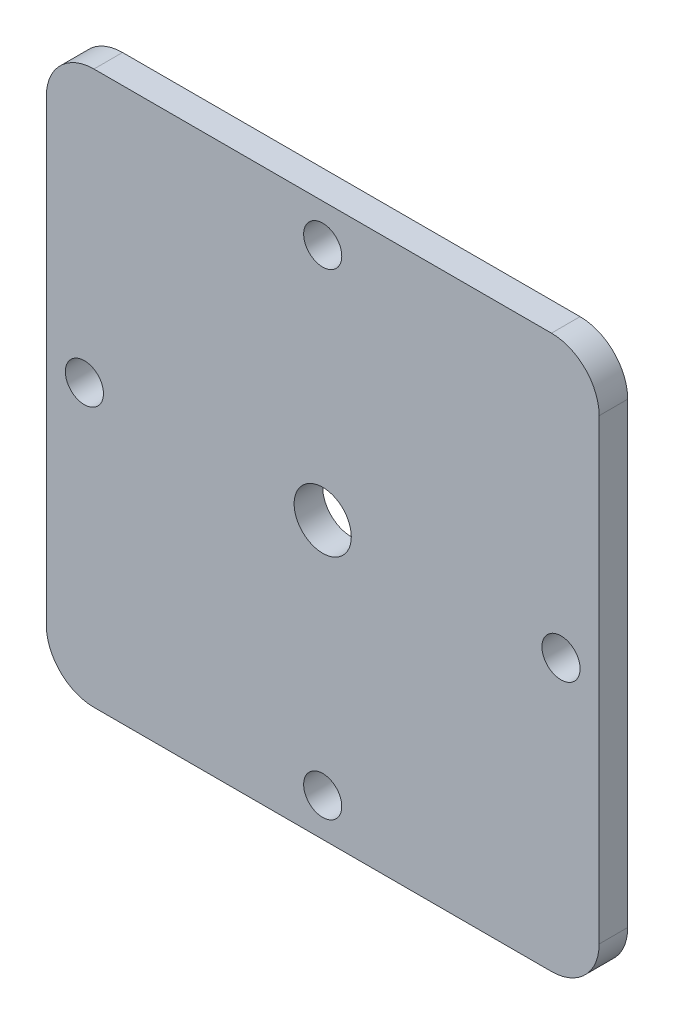
from build123d import *

# Parameters (mm, degrees)
SKETCH_1_W          = 58
SKETCH_1_H          = 58
SKETCH_1_R          = 2
EXTRUDE_1_DEPTH     = 3
FILLET_2_R          = 5
FILLET_3_R          = 5
FILLET_4_R          = 5
FILLET_5_R          = 5
SKETCH_2_R          = 3
CUT_EXTRUDE_1_DEPTH = 3


with BuildPart() as part:
    # Эскиз1 → Бобышка-Вытянуть1 (new body)
    with BuildSketch(Plane.XY):
        Rectangle(SKETCH_1_W, SKETCH_1_H)
        with Locations((0, 25)):
            Circle(SKETCH_1_R, mode=Mode.SUBTRACT)
        with Locations(Location((-25, 0, 0), (0, 0, 180))):
            Circle(SKETCH_1_R, mode=Mode.SUBTRACT)
        with Locations(Location((0, -25, 0), (0, 0, 180))):
            Circle(SKETCH_1_R, mode=Mode.SUBTRACT)
        with Locations(Location((25, 0, 0), (0, 0, 180))):
            Circle(SKETCH_1_R, mode=Mode.SUBTRACT)
    extrude(amount=EXTRUDE_1_DEPTH)

    # Скругление2
    fillet_2_edges = [part.edges().sort_by_distance(p)[0] for p in [
        (29, -29, 1.5),
    ]]
    fillet(fillet_2_edges, radius=FILLET_2_R)

    # Скругление3
    fillet_3_edges = [part.edges().sort_by_distance(p)[0] for p in [
        (-29, -29, 1.5),
    ]]
    fillet(fillet_3_edges, radius=FILLET_3_R)

    # Скругление4
    fillet_4_edges = [part.edges().sort_by_distance(p)[0] for p in [
        (-29, 29, 1.5),
    ]]
    fillet(fillet_4_edges, radius=FILLET_4_R)

    # Скругление5
    fillet_5_edges = [part.edges().sort_by_distance(p)[0] for p in [
        (29, 29, 1.5),
    ]]
    fillet(fillet_5_edges, radius=FILLET_5_R)

    # Эскиз2 → Вырез-Вытянуть1 (cut)
    with BuildSketch(Plane.XY.offset(3)):
        Circle(SKETCH_2_R)
    extrude(amount=-CUT_EXTRUDE_1_DEPTH, mode=Mode.SUBTRACT)


solid = part.part
